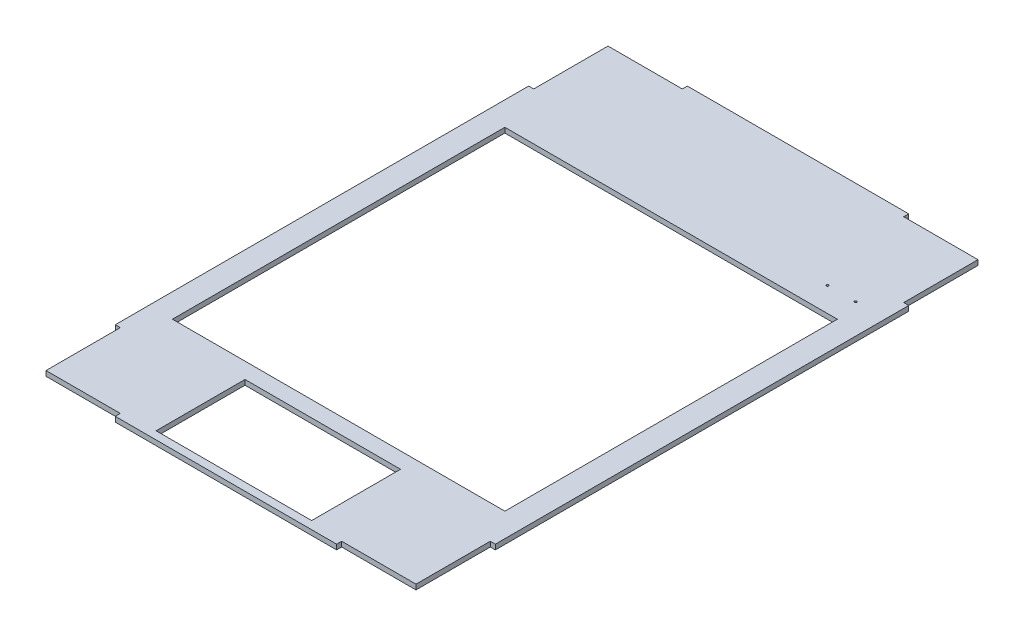
from build123d import *

# Parameters (mm, degrees)
SKETCH1_W           = 479
SKETCH1_H           = 721
SKETCH1_W_2         = 419
SKETCH1_H_2         = 419
SKETCH1_W_3         = 196
SKETCH1_H_3         = 112
BOSS_EXTRUDE1_DEPTH = 3.175
CUT_EXTRUDE1_DEPTH  = 441.375774197
SKETCH3_R           = 1.375
CUT_EXTRUDE2_DEPTH  = 441.375774197


with BuildPart() as part:
    # Sketch1 → Boss-Extrude1 (new, symmetric)
    with BuildSketch(Plane(origin=(0, 0, 0), x_dir=(1, 0, 0), z_dir=(0, 1, 0))):
        with Locations((0, 9)):
            Rectangle(SKETCH1_W, SKETCH1_H)
        Rectangle(SKETCH1_W_2, SKETCH1_H_2, mode=Mode.SUBTRACT)
        with Locations((0, -285.5)):
            Rectangle(SKETCH1_W_3, SKETCH1_H_3, mode=Mode.SUBTRACT)
    extrude(amount=BOSS_EXTRUDE1_DEPTH, both=True)

    # Sketch2 → Cut-Extrude1 (cut, through all)
    with BuildSketch(Plane(origin=(0, 3.175, 0), x_dir=(1, 0, 0), z_dir=(0, 1, 0))):
        Polygon((-239.5, 369.5), (-239.5, 269.5), (-233.15, 269.5), (-233.15, 363.15), (-139.5, 363.15), (-139.5, 369.5), align=None)
        Polygon((239.5, 369.5), (139.5, 369.5), (139.5, 363.15), (233.15, 363.15), (233.15, 269.5), (239.5, 269.5), align=None)
        Polygon((239.5, -351.5), (239.5, -251.5), (233.15, -251.5), (233.15, -345.15), (139.5, -345.15), (139.5, -351.5), align=None)
        Polygon((-239.5, -351.5), (-139.5, -351.5), (-139.5, -345.15), (-233.15, -345.15), (-233.15, -251.5), (-239.5, -251.5), align=None)
    extrude(amount=-CUT_EXTRUDE1_DEPTH, mode=Mode.SUBTRACT)

    # Sketch3 → Cut-Extrude2 (cut, through all)
    with BuildSketch(Plane(origin=(0, 3.175, 0), x_dir=(1, 0, 0), z_dir=(0, 1, 0))):
        with Locations(Location((166.32, 240.12, 0), (0, 0, 270))):
            Circle(SKETCH3_R)
        with Locations(Location((201.88, 240.12, 0), (0, 0, 270))):
            Circle(SKETCH3_R)
    extrude(amount=-CUT_EXTRUDE2_DEPTH, mode=Mode.SUBTRACT)


solid = part.part
